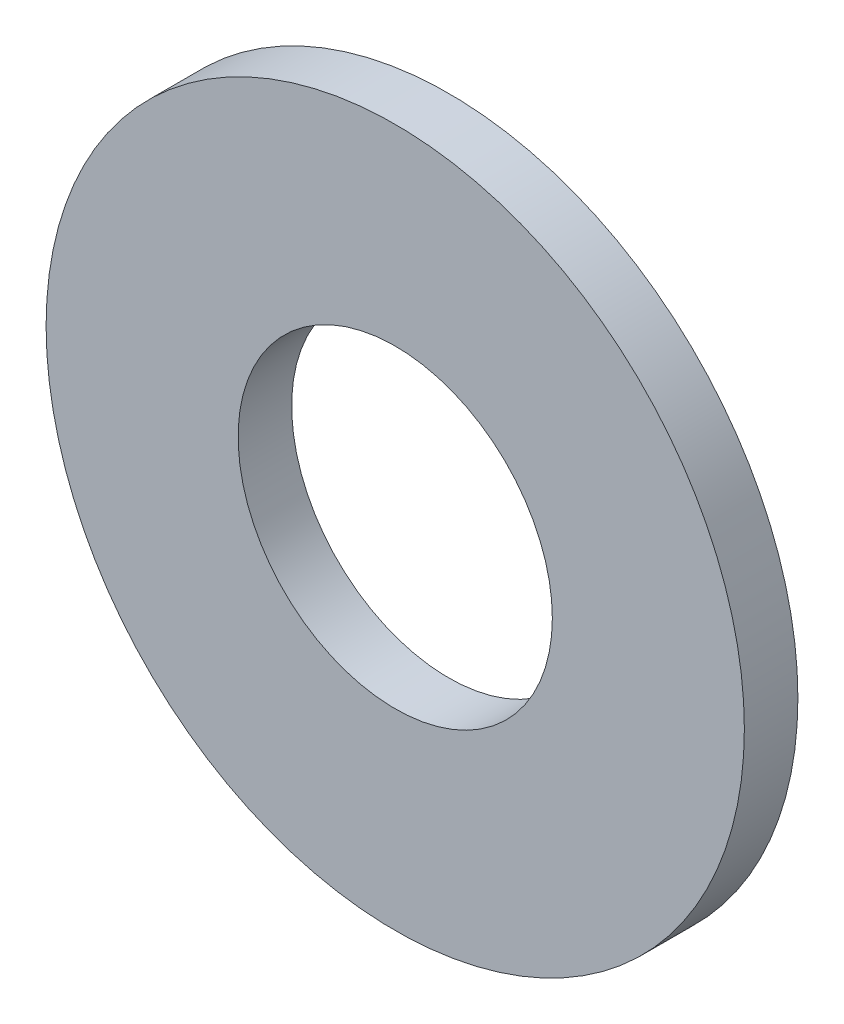
from build123d import *

# Parameters (mm, degrees)
ESQUISSE1_R        = 15
ESQUISSE1_R_2      = 6.75
BOSS_EXTRU_1_DEPTH = 1.15


with BuildPart() as part:
    # Esquisse1 → Boss.-Extru.1 (new, symmetric)
    with BuildSketch(Plane.XY):
        Circle(ESQUISSE1_R)
        Circle(ESQUISSE1_R_2, mode=Mode.SUBTRACT)
    extrude(amount=BOSS_EXTRU_1_DEPTH, both=True)


solid = part.part
